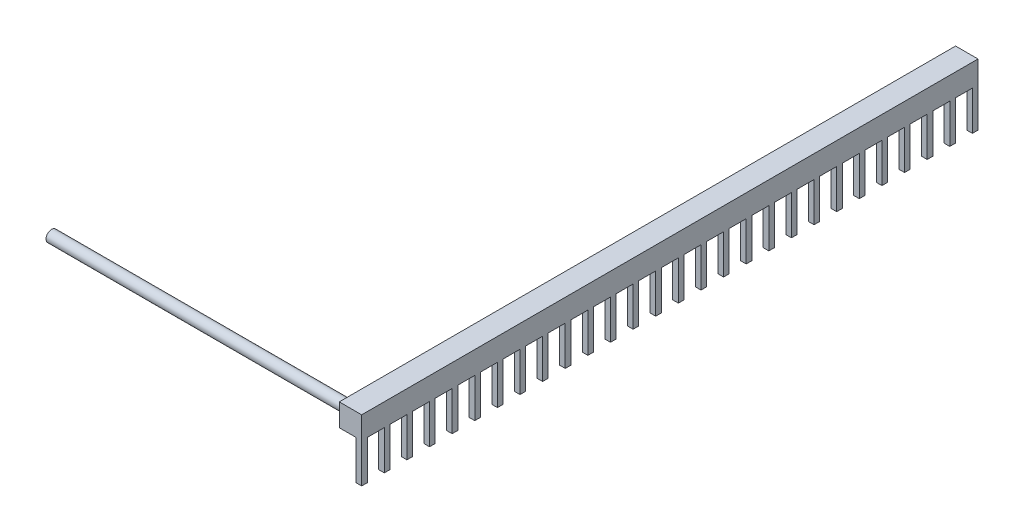
from build123d import *

# Parameters (mm, degrees)
SKETCH1_W           = 20
SKETCH1_H           = 20
BOSS_EXTRUDE1_DEPTH = 550
SKETCH2_R           = 5
BOSS_EXTRUDE2_DEPTH = 266.7
SKETCH3_W           = 5
SKETCH3_H           = 35
BOSS_EXTRUDE3_DEPTH = 5
LPATTERN1_COUNT     = 28
LPATTERN1_PITCH     = 20.1852


with BuildPart() as part:
    # Sketch1 → Boss-Extrude1 (new body)
    with BuildSketch(Plane.XY):
        with Locations((-10, 10)):
            Rectangle(SKETCH1_W, SKETCH1_H)
    extrude(amount=BOSS_EXTRUDE1_DEPTH)

    # Sketch2 → Boss-Extrude2 (add)
    with BuildSketch(Plane.ZY.offset(20)):
        with Locations(Location((540, 10, 0), (0, 0, 90))):
            Circle(SKETCH2_R)
    extrude(amount=BOSS_EXTRUDE2_DEPTH)

    # Sketch3 → Boss-Extrude3 (add)
    with BuildSketch(Plane.XY.offset(550)):
        with Locations((-2.5, -17.5)):
            Rectangle(SKETCH3_W, SKETCH3_H)
    boss_extrude3 = extrude(amount=-BOSS_EXTRUDE3_DEPTH)

    # LPattern1: Boss-Extrude3 ×28
    with Locations(*[(0, 0, -i * LPATTERN1_PITCH) for i in range(1, LPATTERN1_COUNT)]):
        add(boss_extrude3)


solid = part.part
